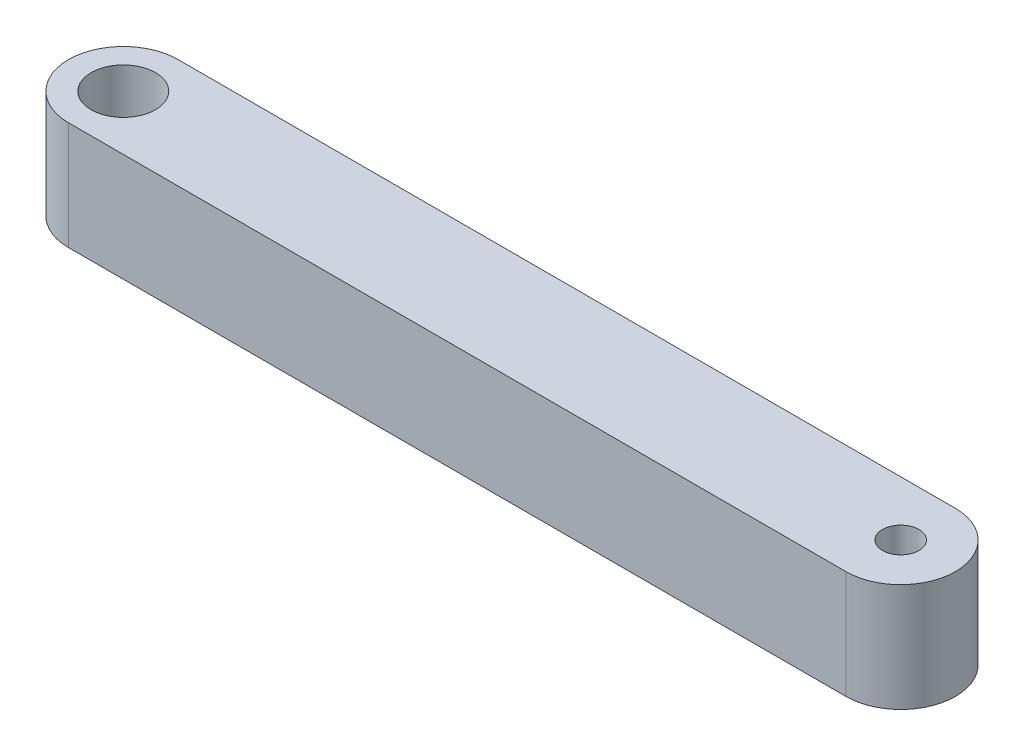
from build123d import *

# Parameters (mm, degrees)
SKETCH1_R           = 1.5875
SKETCH1_R_2         = 0.9
BOSS_EXTRUDE1_DEPTH = 5.334


with BuildPart() as part:
    # Sketch1 → Boss-Extrude1 (new body)
    with BuildSketch(Plane(origin=(0, 0, 0), x_dir=(1, 0, 0), z_dir=(0, 1, 0))):
        with BuildLine():
            Line((-17.298840206, 4.645974227), (21.055159794, 4.645974227))
            ThreePointArc((21.055159794, 4.645974227), (23.757073883, 1.944060137), (21.055159794, -0.757853952))
            Line((21.055159794, -0.757853952), (-17.298840206, -0.757853952))
            ThreePointArc((-17.298840206, -0.757853952), (-20.000754296, 1.944060137), (-17.298840206, 4.645974227))
        make_face()
        with Locations(Location((-17.298840206, 1.944060137, 0), (0, 0, 270))):
            Circle(SKETCH1_R, mode=Mode.SUBTRACT)
        with Locations(Location((21.055159794, 1.944060137, 0), (0, 0, 270))):
            Circle(SKETCH1_R_2, mode=Mode.SUBTRACT)
    extrude(amount=BOSS_EXTRUDE1_DEPTH)


solid = part.part
